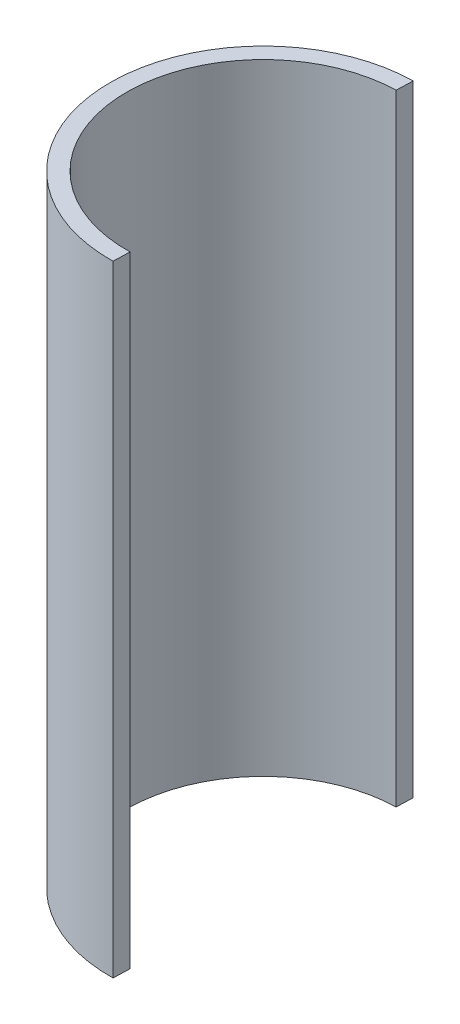
from build123d import *

# Parameters (mm, degrees)
BOSS_EXTRUDE1_DEPTH = 150


with BuildPart() as part:
    # Sketch1 → Boss-Extrude1 (new body)
    with BuildSketch(Plane(origin=(0, 0, 0), x_dir=(1, 0, 0), z_dir=(0, 1, 0))):
        with BuildLine():
            Line((-0.725350773, 36.992889401), (-0.855268168, 32.988915053))
            ThreePointArc((-0.855268168, 32.988915053), (-32.988915053, -0.855268168), (0.855268168, -32.988915053))
            Line((0.855268168, -32.988915053), (0.725350773, -36.992889401))
            ThreePointArc((0.725350773, -36.992889401), (-36.992889401, -0.725350773), (-0.725350773, 36.992889401))
        make_face()
    extrude(amount=BOSS_EXTRUDE1_DEPTH)


solid = part.part
